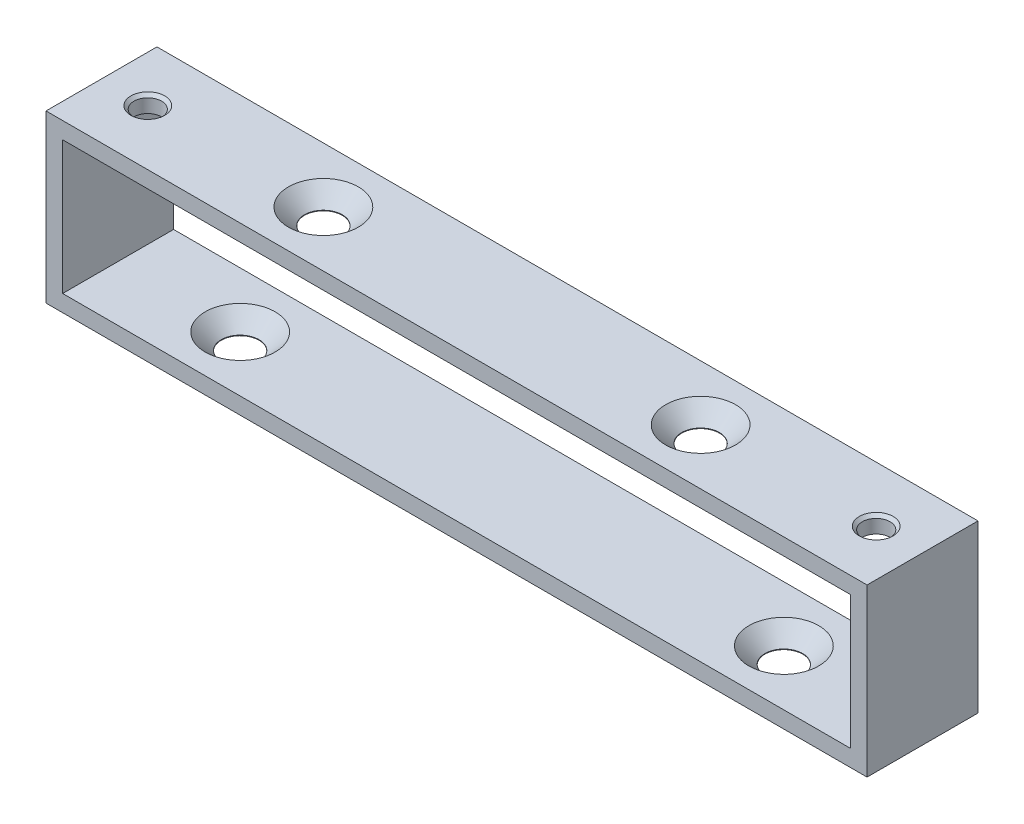
from build123d import *

# Parameters (mm, degrees)
SKIZZE1_W                                      = 74
SKIZZE1_H                                      = 15
AUFSATZ_LINEAR_AUSTRAGEN1_DEPTH                = 10
SCHNITT_LINEAR_AUSTRAGEN1_REACH                = 61.351
SKIZZE2_W                                      = 71
SKIZZE2_H                                      = 12
FORMSENKUNG_F_R_M3_LINSENSENKSCHRAUB_2_COUNT   = 2
FORMSENKUNG_F_R_M3_LINSENSENKSCHRAUB_2_PITCH   = 34
M3_GEWINDEBOHRUNG1_AT_2_COUNT                  = 2
M3_GEWINDEBOHRUNG1_AT_2_PITCH                  = 65.65
FORMSENKUNG_F_R_M3_LINSENSENKSCHRAUB_3_A_COUNT = 2
FORMSENKUNG_F_R_M3_LINSENSENKSCHRAUB_3_A_PITCH = 49


with BuildPart() as part:
    # Skizze1 → Aufsatz-Linear austragen1 (new body)
    with BuildSketch(Plane.XY):
        with Locations((20.392098069, -3.844827586)):
            Rectangle(SKIZZE1_W, SKIZZE1_H)
    extrude(amount=AUFSATZ_LINEAR_AUSTRAGEN1_DEPTH)

    # Skizze2 → Schnitt-Linear austragen1 (cut, up to next)
    with BuildSketch(Plane.XY.offset(10), mode=Mode.PRIVATE) as schnitt_linear_austragen1_sk1:
        with Locations((20.392098069, -3.844827586)):
            Rectangle(SKIZZE2_W, SKIZZE2_H)
    schnitt_linear_austragen1_tool1 = extrude(schnitt_linear_austragen1_sk1.sketch, amount=-SCHNITT_LINEAR_AUSTRAGEN1_REACH, mode=Mode.PRIVATE) & part.part
    add(schnitt_linear_austragen1_tool1.solids().sort_by_distance((20.392098, -3.844828, 10))[0], mode=Mode.SUBTRACT)

    # Skizze10 → Formsenkung f_r M3 Linsensenkschraube mi (revolve, cut)
    with BuildSketch(Plane(origin=(3.392098069, 3.655172414, 5), x_dir=(0, 0, 1), z_dir=(1, 0, 0))):
        Polygon((0, 0), (0, 1.5), (1.7, 1.5), (1.7, 1.45), (3.15, 0), align=None)
    formsenkung_f_r_m3_linsensenkschraube_mi = revolve(axis=Axis((3.392098069, 10.005172414, 5), (0, -1, 0)), mode=Mode.SUBTRACT)

    # Formsenkung f_r M3 Linsensenkschraub 2: Formsenkung f_r M3 Linsensenkschraube mi ×2
    with Locations(*[(i * FORMSENKUNG_F_R_M3_LINSENSENKSCHRAUB_2_PITCH, 0, 0) for i in range(1, FORMSENKUNG_F_R_M3_LINSENSENKSCHRAUB_2_COUNT)]):
        add(formsenkung_f_r_m3_linsensenkschraube_mi, mode=Mode.SUBTRACT)

    # Skizze12 → M3 Gewindebohrung1 (revolve, cut)
    with BuildSketch(Plane(origin=(53.217098069, 3.655172414, 5), x_dir=(0, 0, 1), z_dir=(1, 0, 0))):
        Polygon((0, 0), (0, 1.5), (1.25, 1.5), (1.25, 0.275), (1.525, 0), align=None)
    m3_gewindebohrung1 = revolve(axis=Axis((53.217098069, 10.005172414, 5), (0, -1, 0)), mode=Mode.SUBTRACT)

    # M3 Gewindebohrung1 at 2: M3 Gewindebohrung1 ×2
    with Locations(*[(-i * M3_GEWINDEBOHRUNG1_AT_2_PITCH, 0, 0) for i in range(1, M3_GEWINDEBOHRUNG1_AT_2_COUNT)]):
        add(m3_gewindebohrung1, mode=Mode.SUBTRACT)

    # Skizze16 → Formsenkung f_r M3 Linsensenkschraub 3 (revolve, cut)
    with BuildSketch(Plane(origin=(44.892098069, -9.844827586, 5), x_dir=(0, 0, 1), z_dir=(1, 0, 0))):
        Polygon((0, 0), (0, 1.5), (1.7, 1.5), (1.7, 1.45), (3.15, 0), align=None)
    formsenkung_f_r_m3_linsensenkschraub_3 = revolve(axis=Axis((44.892098069, -3.494827586, 5), (0, -1, 0)), mode=Mode.SUBTRACT)

    # Formsenkung f_r M3 Linsensenkschraub 3 a: Formsenkung f_r M3 Linsensenkschraub 3 ×2
    with Locations(*[(-i * FORMSENKUNG_F_R_M3_LINSENSENKSCHRAUB_3_A_PITCH, 0, 0) for i in range(1, FORMSENKUNG_F_R_M3_LINSENSENKSCHRAUB_3_A_COUNT)]):
        add(formsenkung_f_r_m3_linsensenkschraub_3, mode=Mode.SUBTRACT)


solid = part.part
